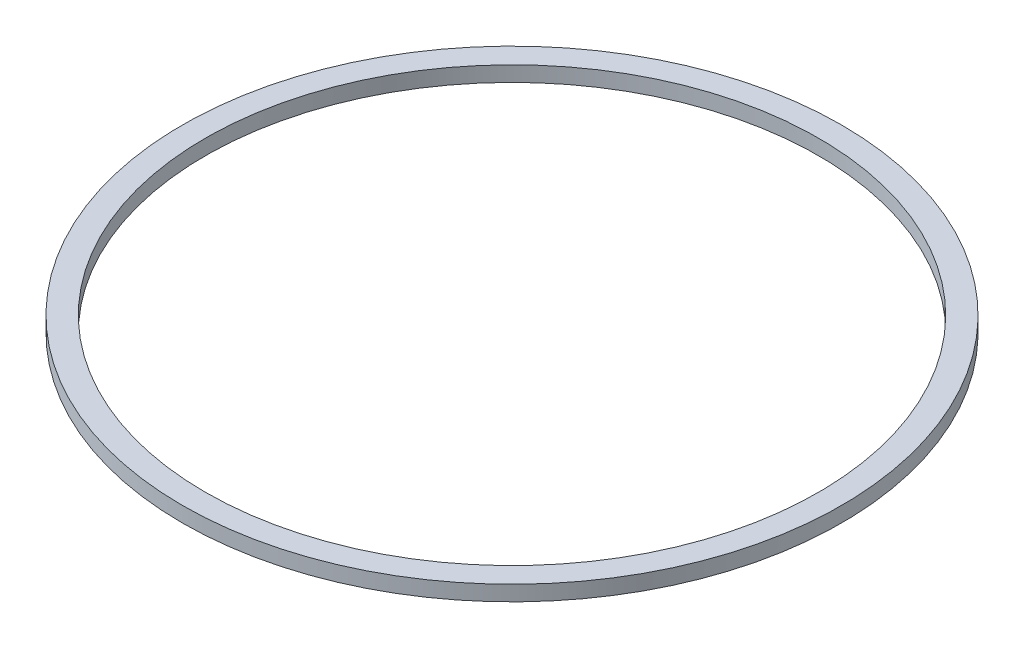
from build123d import *

# Parameters (mm, degrees)
SKETCH1_R           = 43.2
SKETCH1_R_2         = 40.2
BOSS_EXTRUDE1_DEPTH = 2


with BuildPart() as part:
    # Sketch1 → Boss-Extrude1 (new body)
    with BuildSketch(Plane(origin=(0, 0, 0), x_dir=(1, 0, 0), z_dir=(0, 1, 0))):
        with Locations(Location((0, 0, 0), (0, 0, 270))):
            Circle(SKETCH1_R)
        with Locations(Location((0, 0, 0), (0, 0, 270))):
            Circle(SKETCH1_R_2, mode=Mode.SUBTRACT)
    extrude(amount=BOSS_EXTRUDE1_DEPTH)


solid = part.part
